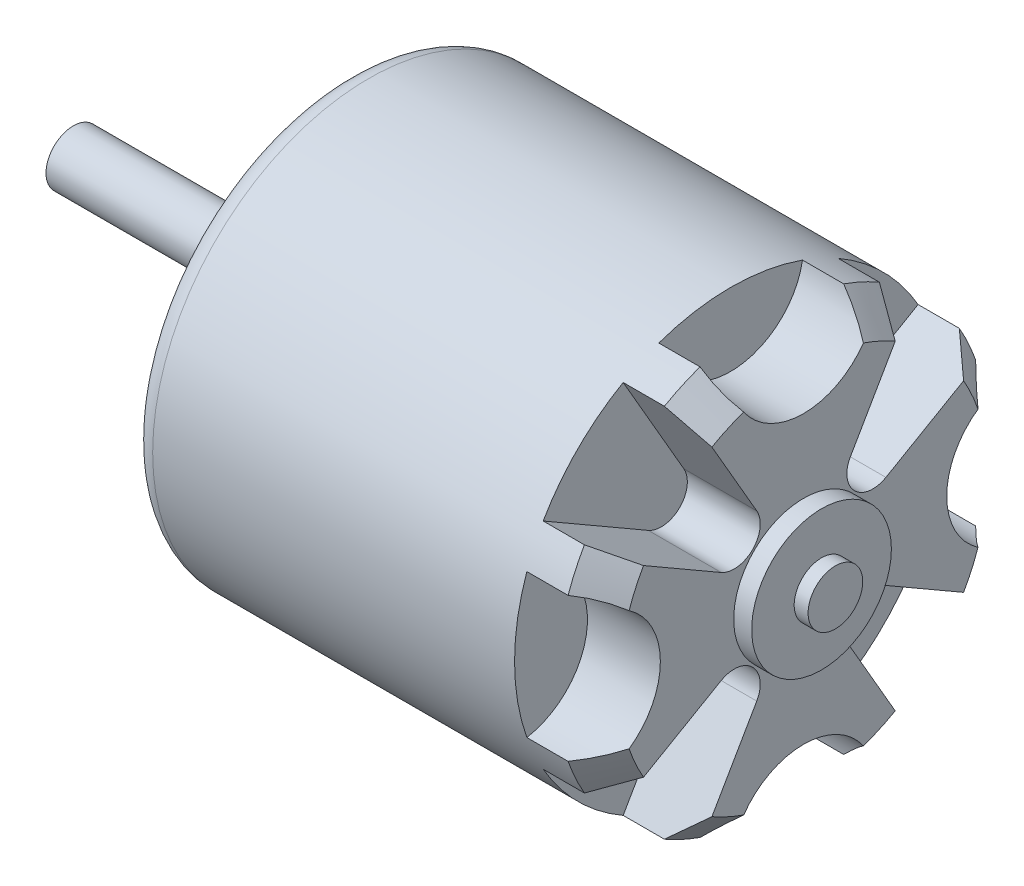
from build123d import *

# Parameters (mm, degrees)
SKETCH1_R                       = 31.623
BOSS_EXTRUDE1_DEPTH             = 66.802
CUT_EXTRUDE1_START              = -10.668
CUT_EXTRUDE1_DEPTH              = 10.668
CHAMFER1_SIZE                   = 4.6355
SKETCH3_R                       = 10.2235
BOSS_EXTRUDE2_DEPTH             = 2.6289
SKETCH4_R                       = 4
BOSS_EXTRUDE3_DEPTH             = 2.032
SKETCH5_R                       = 8.7376
BOSS_EXTRUDE4_DEPTH             = 12.3698
BOSS_EXTRUDE5_START             = 27.686
SKETCH6_R                       = 4
BOSS_EXTRUDE5_DEPTH             = 27.686
M4X0_7_TAPPED_HOLE1_D           = 3.3
M4X0_7_TAPPED_HOLE1_DEPTH       = 9.906
M4X0_7_TAPPED_HOLE1_CSINK_D     = 4.05
M4X0_7_TAPPED_HOLE1_CSINK_ANGLE = 90
M4X0_7_TAPPED_HOLE1_TIP         = 0.991420021
FILLET1_R                       = 3.175


with BuildPart() as part:
    # Sketch1 → Boss-Extrude1 (new body)
    with BuildSketch(Plane(origin=(0, 0, 0), x_dir=(0, 0, -1), z_dir=(1, 0, 0))):
        Circle(SKETCH1_R)
    extrude(amount=BOSS_EXTRUDE1_DEPTH)

    # Sketch2 → Cut-Extrude1 (cut)
    with BuildSketch(Plane(origin=(66.802, 0, 0), x_dir=(0, 0, -1), z_dir=(1, 0, 0)).offset(CUT_EXTRUDE1_START)):
        with BuildLine():
            Line((-27.43403991, 15.728559476), (-12.052689417, 6.848132628))
            ThreePointArc((-12.052689417, 6.848132628), (-7.45361258, 7.45361258), (-6.848132628, 12.052689417))
            Line((-6.848132628, 12.052689417), (-15.728559476, 27.43403991))
            ThreePointArc((-15.728559476, 27.43403991), (-22.360837741, 22.360837741), (-27.43403991, 15.728559476))
        make_face()
        with BuildLine():
            ThreePointArc((-29.823578313, -10.515146485), (-20.955, 0), (-29.823578313, 10.515146485))
            ThreePointArc((-29.823578313, 10.515146485), (-31.623, 0), (-29.823578313, -10.515146485))
        make_face()
        with BuildLine():
            ThreePointArc((6.848132628, 12.052689417), (7.45361258, 7.45361258), (12.052689417, 6.848132628))
            Line((12.052689417, 6.848132628), (27.43403991, 15.728559476))
            ThreePointArc((27.43403991, 15.728559476), (22.360837741, 22.360837741), (15.728559476, 27.43403991))
            Line((15.728559476, 27.43403991), (6.848132628, 12.052689417))
        make_face()
        with BuildLine():
            ThreePointArc((-6.848132628, -12.052689417), (-7.45361258, -7.45361258), (-12.052689417, -6.848132628))
            Line((-12.052689417, -6.848132628), (-27.43403991, -15.728559476))
            ThreePointArc((-27.43403991, -15.728559476), (-22.360837741, -22.360837741), (-15.728559476, -27.43403991))
            Line((-15.728559476, -27.43403991), (-6.848132628, -12.052689417))
        make_face()
        with BuildLine():
            ThreePointArc((10.515146485, 29.823578313), (0, 31.623), (-10.515146485, 29.823578313))
            ThreePointArc((-10.515146485, 29.823578313), (0, 20.955), (10.515146485, 29.823578313))
        make_face()
        with BuildLine():
            ThreePointArc((12.052689417, -6.848132628), (7.45361258, -7.45361258), (6.848132628, -12.052689417))
            Line((6.848132628, -12.052689417), (15.728559476, -27.43403991))
            ThreePointArc((15.728559476, -27.43403991), (22.360837741, -22.360837741), (27.43403991, -15.728559476))
            Line((27.43403991, -15.728559476), (12.052689417, -6.848132628))
        make_face()
        with BuildLine():
            ThreePointArc((29.823578313, -10.515146485), (31.623, 0), (29.823578313, 10.515146485))
            ThreePointArc((29.823578313, 10.515146485), (20.955, 0), (29.823578313, -10.515146485))
        make_face()
        with BuildLine():
            ThreePointArc((10.515146485, -29.823578313), (0, -20.955), (-10.515146485, -29.823578313))
            ThreePointArc((-10.515146485, -29.823578313), (0, -31.623), (10.515146485, -29.823578313))
        make_face()
    extrude(amount=CUT_EXTRUDE1_DEPTH, mode=Mode.SUBTRACT)

    # Chamfer1
    chamfer1_edges = [part.edges().sort_by_distance(p)[0] for p in [
        (66.802, 13.176133693, -28.747236909),
        (66.802, 28.747236909, -13.176133693),
        (66.802, 28.747236909, 13.176133693),
        (66.802, 13.176133693, 28.747236909),
        (66.802, -13.176133693, 28.747236909),
        (66.802, -28.747236909, 13.176133693),
        (66.802, -28.747236909, -13.176133693),
        (66.802, -13.176133693, -28.747236909),
    ]]
    chamfer(chamfer1_edges, length=CHAMFER1_SIZE)

    # Sketch3 → Boss-Extrude2 (add)
    with BuildSketch(Plane(origin=(66.802, 0, 0), x_dir=(0, 0, -1), z_dir=(1, 0, 0))):
        Circle(SKETCH3_R)
    extrude(amount=BOSS_EXTRUDE2_DEPTH)

    # Sketch4 → Boss-Extrude3 (add)
    with BuildSketch(Plane(origin=(69.4309, 0, 0), x_dir=(0, 0, -1), z_dir=(1, 0, 0))):
        Circle(SKETCH4_R)
    extrude(amount=BOSS_EXTRUDE3_DEPTH)

    # Sketch5 → Boss-Extrude4 (add)
    with BuildSketch(Plane.ZY):
        Circle(SKETCH5_R)
    extrude(amount=BOSS_EXTRUDE4_DEPTH)

    # Sketch6 → Boss-Extrude5 (add)
    with BuildSketch(Plane.ZY.offset(12.3698).offset(BOSS_EXTRUDE5_START)):
        with Locations(Location((0, 0, 0), (0, 0, 180))):
            Circle(SKETCH6_R)
    extrude(amount=-BOSS_EXTRUDE5_DEPTH)

    # M4x0.7 Tapped Hole1
    with Locations(Plane.ZY):
        with Locations((0, 22.05), (-22.05, 0), (0, -22.05), (22.05, 0)):
            CounterSinkHole(M4X0_7_TAPPED_HOLE1_D / 2, M4X0_7_TAPPED_HOLE1_CSINK_D / 2, depth=M4X0_7_TAPPED_HOLE1_DEPTH, counter_sink_angle=M4X0_7_TAPPED_HOLE1_CSINK_ANGLE)
            with Locations((0, 0, -(M4X0_7_TAPPED_HOLE1_DEPTH + M4X0_7_TAPPED_HOLE1_TIP / 2))):  # 118° drill point
                Cone(0, M4X0_7_TAPPED_HOLE1_D / 2, M4X0_7_TAPPED_HOLE1_TIP, mode=Mode.SUBTRACT)

    # Fillet1
    fillet1_edges = [part.edges().sort_by_distance(p)[0] for p in [
        (0, 0, 31.623),
    ]]
    fillet(fillet1_edges, radius=FILLET1_R)


solid = part.part
